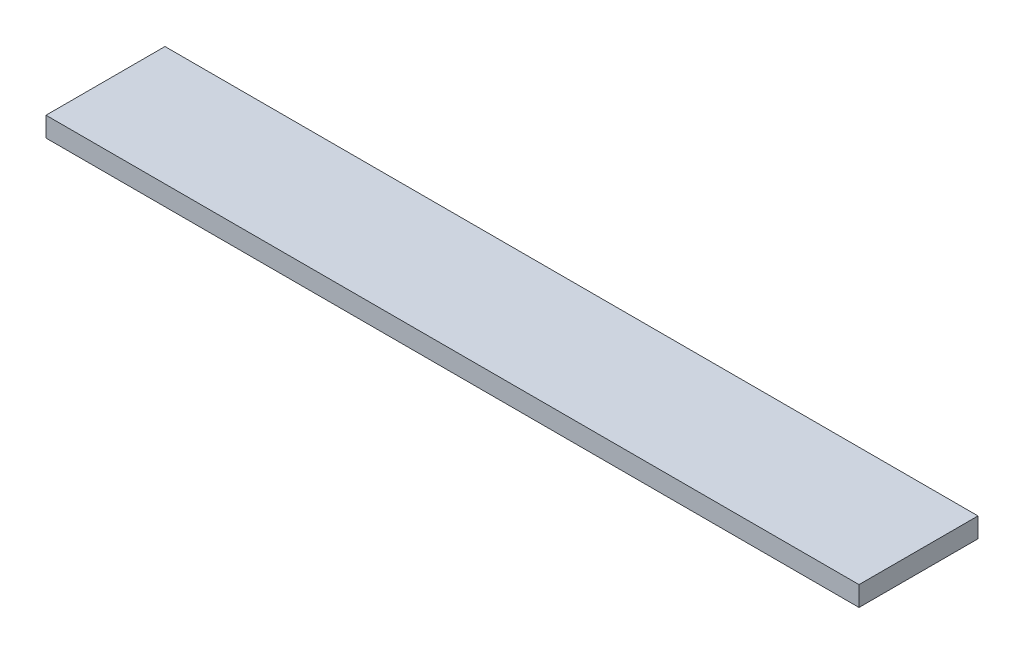
from build123d import *

# Parameters (mm, degrees)
SKETCH1_W             = 41
SKETCH1_H             = 6
BOSS_EXTRUDE1_DEPTH   = 1
BODY_MOVE_COPY1_ANGLE = 90


with BuildPart() as part:
    # Sketch1 → Boss-Extrude1 (new body)
    with BuildSketch(Plane.XY):
        with Locations((-7.811111111, 13.105555556)):
            Rectangle(SKETCH1_W, SKETCH1_H)
    extrude(amount=BOSS_EXTRUDE1_DEPTH)


with BuildPart() as part_1:
    # Body-Move/Copy1: moved
    add(part.part.rotate(Axis((0, 13.105555556, 0.25), (1, 0, 0)), BODY_MOVE_COPY1_ANGLE))


solid = part_1.part
